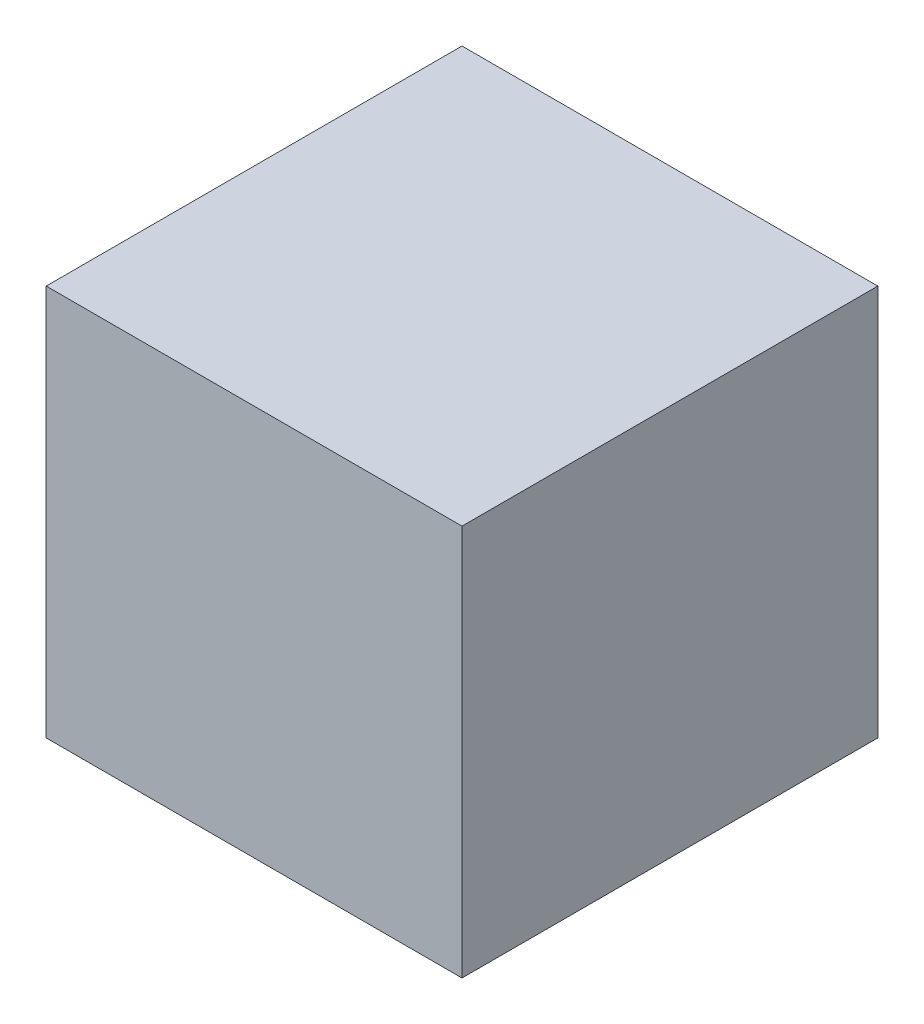
from build123d import *

# Parameters (mm, degrees)
SKETCH1_W           = 85
SKETCH1_H           = 85
BOSS_EXTRUDE1_DEPTH = 80


with BuildPart() as part:
    # Sketch1 → Boss-Extrude1 (new body)
    with BuildSketch(Plane(origin=(0, 0, 0), x_dir=(1, 0, 0), z_dir=(0, 1, 0))):
        Rectangle(SKETCH1_W, SKETCH1_H)
    extrude(amount=BOSS_EXTRUDE1_DEPTH)


solid = part.part
